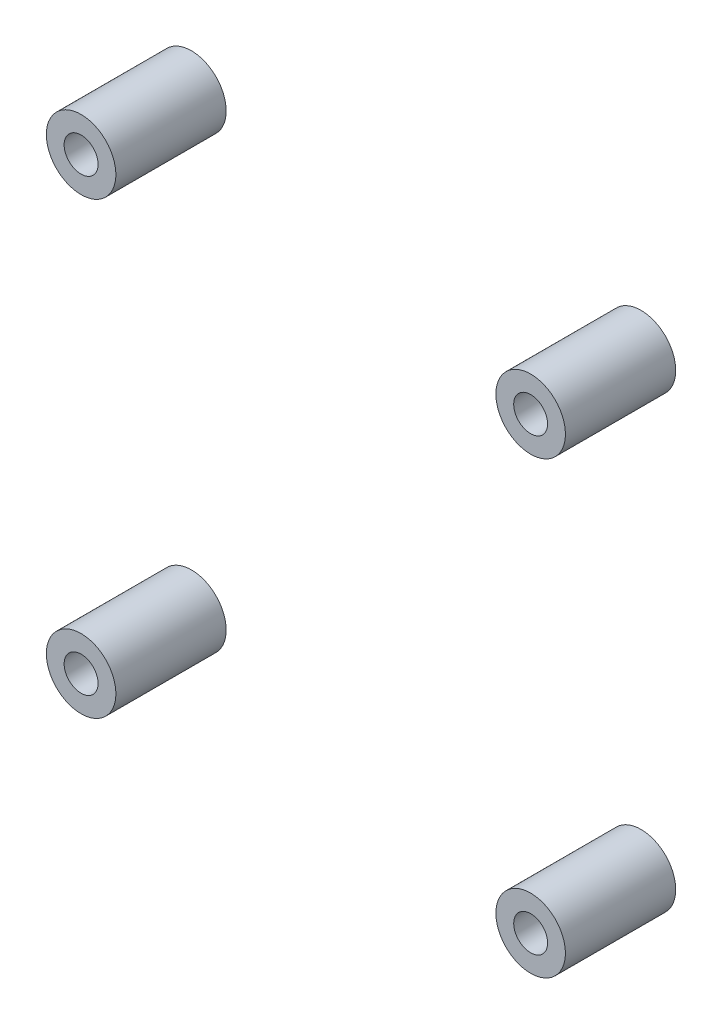
from build123d import *

# Parameters (mm, degrees)
EXTRUDE_START     = -32.800418
SKETCH_1_R        = 2.52
SKETCH_1_R_2      = 1.2295
EXTRUDE_1_DEPTH   = 8
EXTRUDE_1_2_DEPTH = 8
EXTRUDE_1_3_DEPTH = 8
EXTRUDE_1_4_DEPTH = 8


with BuildPart() as part:
    # 草图1 → 凸台-拉伸1 (new body)
    with BuildSketch(Plane.XY.offset(EXTRUDE_START)):
        with Locations(Location((-40.997301149, 14.786658582, 0), (0, 0, 180))):
            Circle(SKETCH_1_R)
        with Locations(Location((-40.997301149, 14.786658582, 0), (0, 0, 180))):
            Circle(SKETCH_1_R_2, mode=Mode.SUBTRACT)
    extrude(amount=-EXTRUDE_1_DEPTH)


with BuildPart() as body_2:
    # 草图1 → Extrude 1 2 (new body)
    with BuildSketch(Plane.XY.offset(EXTRUDE_START)):
        with Locations(Location((-8.399679074, 14.786658582, 0), (0, 0, 180))):
            Circle(SKETCH_1_R)
        with Locations(Location((-8.399679074, 14.786658582, 0), (0, 0, 180))):
            Circle(SKETCH_1_R_2, mode=Mode.SUBTRACT)
    extrude(amount=-EXTRUDE_1_2_DEPTH)


with BuildPart() as body_3:
    # 草图1 → Extrude 1 3 (new body)
    with BuildSketch(Plane.XY.offset(EXTRUDE_START)):
        with Locations(Location((-8.399679074, -17.810963493, 0), (0, 0, 180))):
            Circle(SKETCH_1_R)
        with Locations(Location((-8.399679074, -17.810963493, 0), (0, 0, 180))):
            Circle(SKETCH_1_R_2, mode=Mode.SUBTRACT)
    extrude(amount=-EXTRUDE_1_3_DEPTH)


with BuildPart() as body_4:
    # 草图1 → Extrude 1 4 (new body)
    with BuildSketch(Plane.XY.offset(EXTRUDE_START)):
        with Locations(Location((-40.997301149, -17.810963493, 0), (0, 0, 180))):
            Circle(SKETCH_1_R)
        with Locations(Location((-40.997301149, -17.810963493, 0), (0, 0, 180))):
            Circle(SKETCH_1_R_2, mode=Mode.SUBTRACT)
    extrude(amount=-EXTRUDE_1_4_DEPTH)


solid = Compound([part.part, body_2.part, body_3.part, body_4.part])
